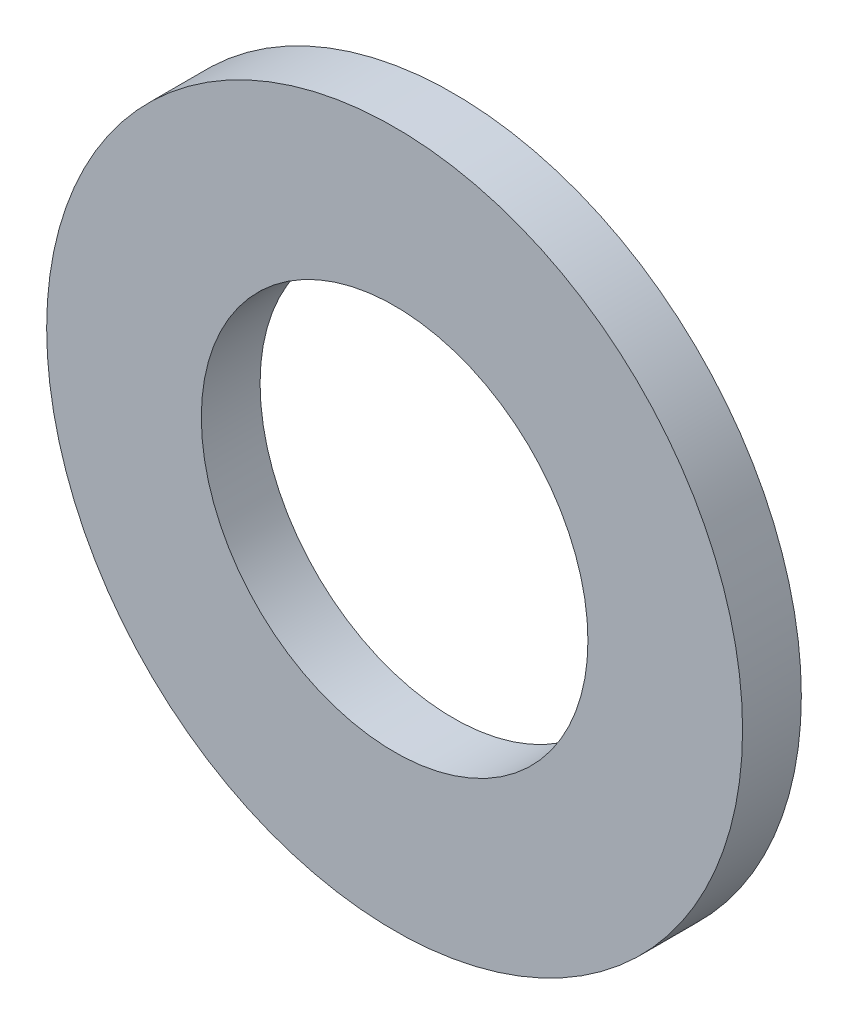
from build123d import *

# Parameters (mm, degrees)
BOSS_EXTRUDE1_DEPTH      = 1.2065
BOSS_EXTRUDE1_DEPTH_BACK = 1.2065
SKETCH3_R                = 14.2875
SKETCH3_R_2              = 7.9375


with BuildPart() as part:
    # Sketch3 → Boss-Extrude1 (new, two sides: drawn at the far end of the back side and taken through both)
    with BuildSketch(Plane.XY.offset(-BOSS_EXTRUDE1_DEPTH_BACK)):
        Circle(SKETCH3_R)
        Circle(SKETCH3_R_2, mode=Mode.SUBTRACT)
    extrude(amount=BOSS_EXTRUDE1_DEPTH + BOSS_EXTRUDE1_DEPTH_BACK)


solid = part.part
